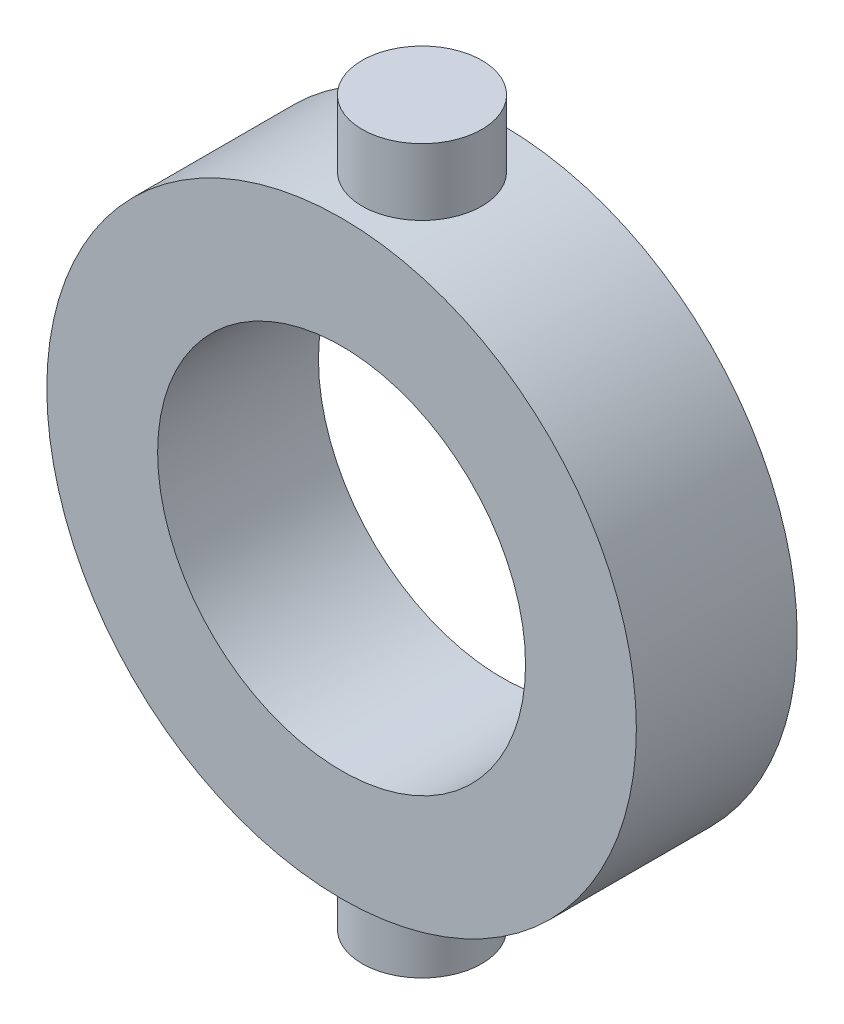
from build123d import *

# Parameters (mm, degrees)
SKETCH1_W           = 25
SKETCH1_H           = 36.281437126
SKETCH3_R           = 13.5
BOSS_EXTRUDE1_DEPTH = 15
SKETCH4_R           = 13.5
BOSS_EXTRUDE3_DEPTH = 15


with BuildPart() as part:
    # Sketch1 → Revolve1 (revolve)
    with BuildSketch(Plane(origin=(0, 0, 0), x_dir=(1, 0, 0), z_dir=(0, 1, 0)), mode=Mode.PRIVATE) as revolve1_sk:
        with Locations((-54, 0)):
            Rectangle(SKETCH1_W, SKETCH1_H)
    revolve(revolve1_sk.sketch.rotate(Axis((0, 0, 0), (0, 0, -1)), 180), axis=Axis((0, 0, 0), (0, 0, -1)))


with BuildPart() as body_2:
    # Sketch3 → Boss-Extrude1 (new body)
    with BuildSketch(Plane(origin=(0, 66.5, 0), x_dir=(1, 0, 0), z_dir=(0, 1, 0))):
        with Locations(Location((0, 0, 0), (0, 0, 270))):
            Circle(SKETCH3_R)
    extrude(amount=BOSS_EXTRUDE1_DEPTH)


with BuildPart() as body_3:
    # Sketch4 → Boss-Extrude3 (new body)
    with BuildSketch(Plane(origin=(0, -66.5, 0), x_dir=(1, 0, 0), z_dir=(0, 1, 0))):
        with Locations(Location((0, 0, 0), (0, 0, 270))):
            Circle(SKETCH4_R)
    extrude(amount=-BOSS_EXTRUDE3_DEPTH)


solid = Compound([part.part, body_2.part, body_3.part])
